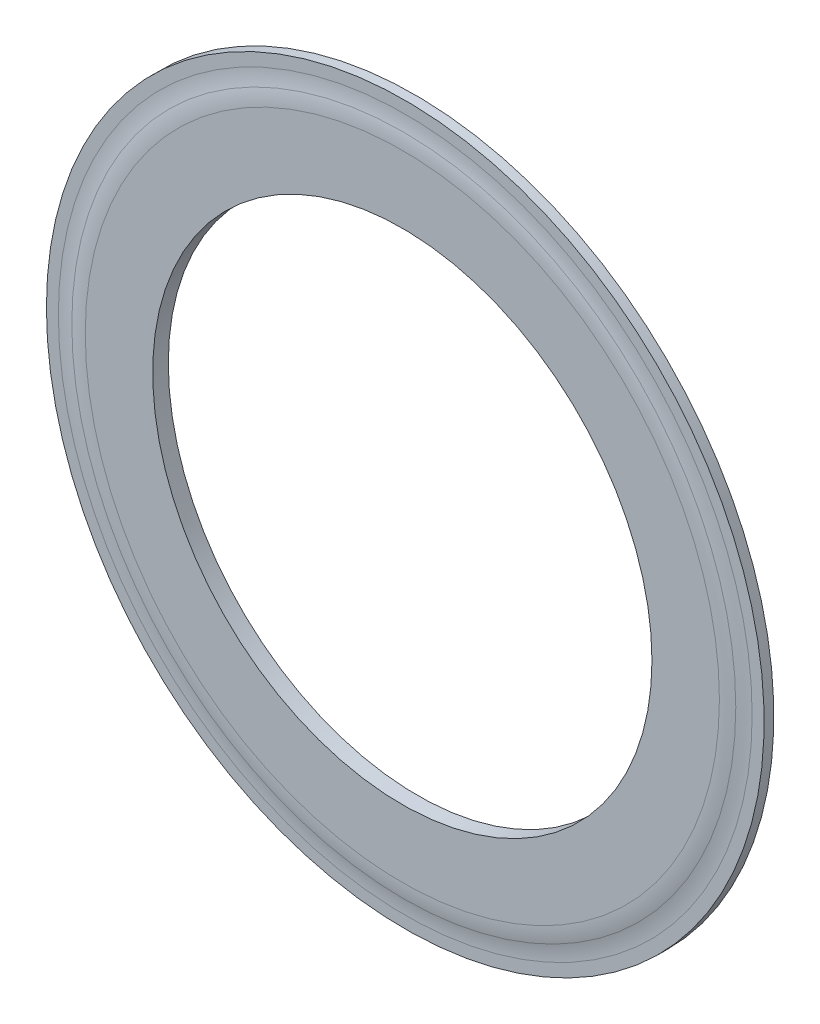
from build123d import *

# Parameters (mm, degrees)
SKETCH4_R          = 25.4
CUT_EXTRUDE1_DEPTH = 2.54


with BuildPart() as part:
    # Sketch3 → Revolve1 (revolve)
    with BuildSketch(Plane(origin=(0, 0, 0), x_dir=(0, 0, -1), z_dir=(1, 0, 0)), mode=Mode.PRIVATE) as revolve1_sk:
        with BuildLine():
            Line((0.49609375, 36.5125), (-0.49609375, 36.5125))
            Line((-0.49609375, 36.5125), (-0.49609375, 35.2980625))
            ThreePointArc((-0.49609375, 35.2980625), (-0.53338976, 34.535400038), (-0.644921875, 33.780015625))
            ThreePointArc((-0.644921875, 33.780015625), (-0.75645399, 33.024631212), (-0.79375, 32.26196875))
            Line((-0.79375, 32.26196875), (-0.79375, 18.70075))
            ThreePointArc((-0.79375, 18.70075), (-0.756233853, 18.289154795), (-0.644921875, 17.891125))
            ThreePointArc((-0.644921875, 17.891125), (-0.533609897, 17.493095205), (-0.49609375, 17.0815))
            Line((-0.49609375, 17.0815), (-0.49609375, 16.271875))
            Line((-0.49609375, 16.271875), (0.49609375, 16.271875))
            Line((0.49609375, 16.271875), (0.49609375, 17.0815))
            ThreePointArc((0.49609375, 17.0815), (0.533609897, 17.493095205), (0.644921875, 17.891125))
            ThreePointArc((0.644921875, 17.891125), (0.756233853, 18.289154795), (0.79375, 18.70075))
            Line((0.79375, 18.70075), (0.79375, 32.26196875))
            ThreePointArc((0.79375, 32.26196875), (0.75645399, 33.024631212), (0.644921875, 33.780015625))
            ThreePointArc((0.644921875, 33.780015625), (0.53338976, 34.535400038), (0.49609375, 35.2980625))
            Line((0.49609375, 35.2980625), (0.49609375, 36.5125))
        make_face()
    revolve(revolve1_sk.sketch.rotate(Axis((0, 0, -0.79375), (0, 0, 1)), 90), axis=Axis((0, 0, -0.79375), (0, 0, 1)))

    # Sketch4 → Cut-Extrude1 (cut)
    with BuildSketch(Plane.XY.offset(0.79375)):
        Circle(SKETCH4_R)
    extrude(amount=-CUT_EXTRUDE1_DEPTH, mode=Mode.SUBTRACT)


solid = part.part
